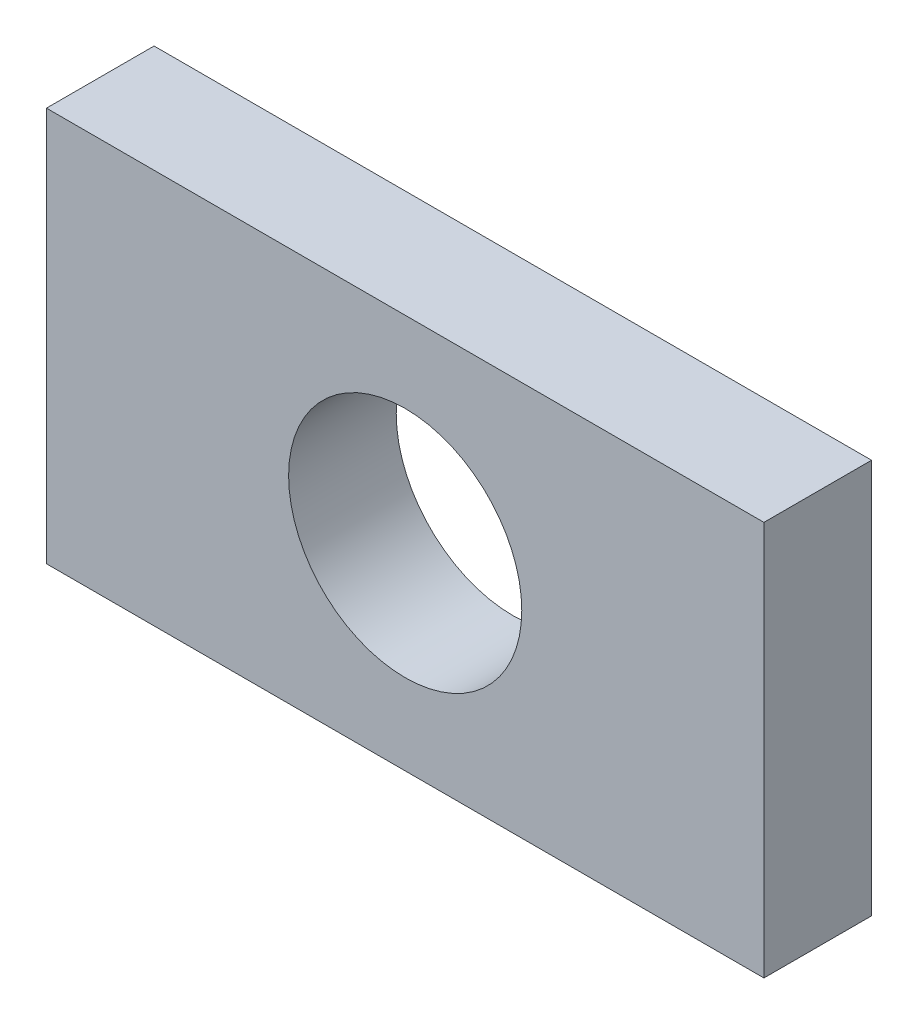
from build123d import *

# Parameters (mm, degrees)
SKETCH_1_W      = 20
SKETCH_1_H      = 11
SKETCH_1_R      = 3.25
EXTRUDE_1_DEPTH = 3


with BuildPart() as part:
    # Эскиз1 → Бобышка-Вытянуть1 (new body)
    with BuildSketch(Plane.XY):
        with Locations((0, 411.5)):
            Rectangle(SKETCH_1_W, SKETCH_1_H)
        with Locations((0, 411.5)):
            Circle(SKETCH_1_R, mode=Mode.SUBTRACT)
    extrude(amount=-EXTRUDE_1_DEPTH)


solid = part.part
